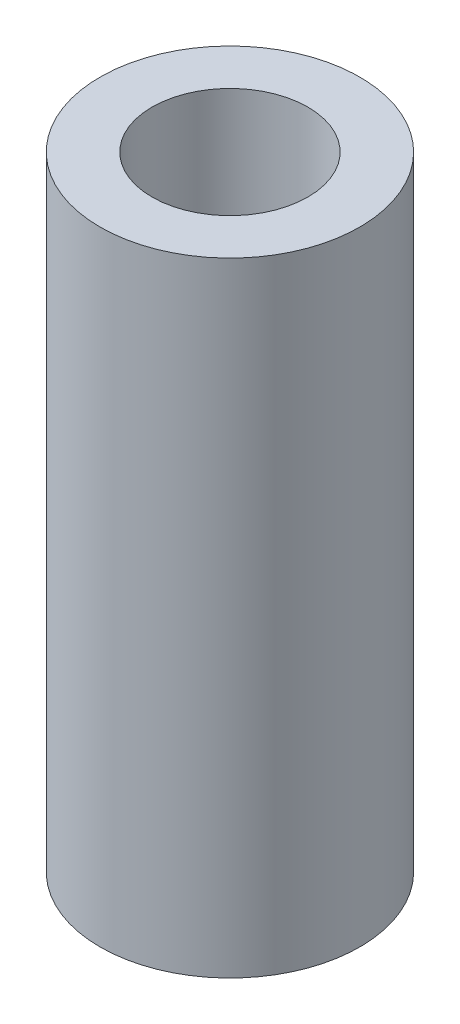
from build123d import *

# Parameters (mm, degrees)
SKETCH1_R           = 25
SKETCH1_R_2         = 15
BOSS_EXTRUDE1_DEPTH = 120


with BuildPart() as part:
    # Sketch1 → Boss-Extrude1 (new body)
    with BuildSketch(Plane(origin=(0, 0, 0), x_dir=(1, 0, 0), z_dir=(0, 1, 0))):
        with Locations(Location((0, 0, 0), (0, 0, 270))):
            Circle(SKETCH1_R)
        with Locations(Location((0, 0, 0), (0, 0, 270))):
            Circle(SKETCH1_R_2, mode=Mode.SUBTRACT)
    extrude(amount=BOSS_EXTRUDE1_DEPTH)


solid = part.part
